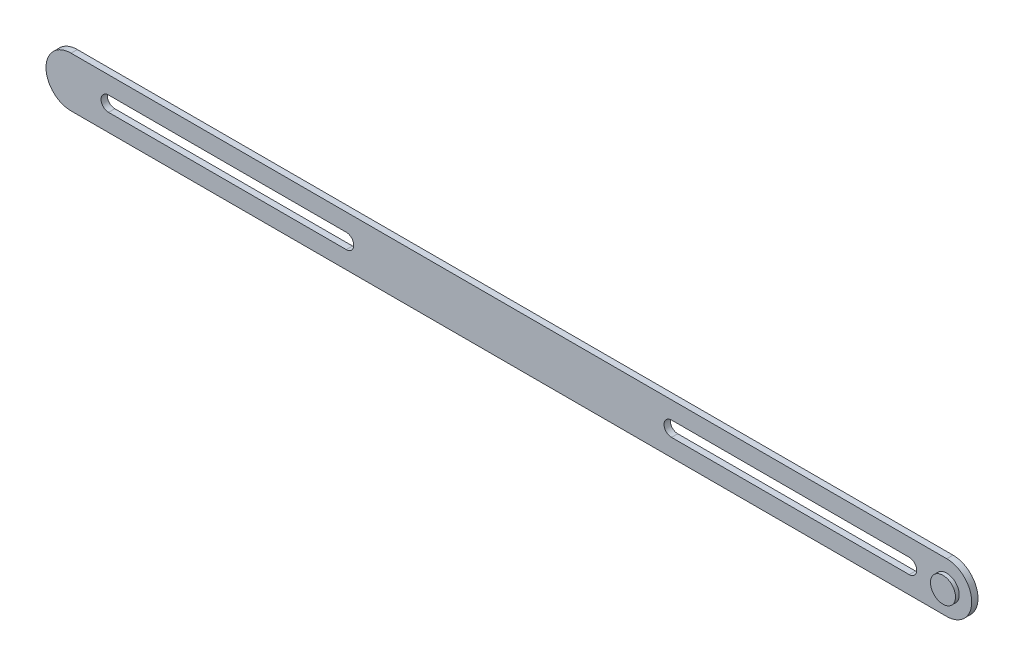
from build123d import *

# Parameters (mm, degrees)
SKETCH1_R                = 2.5
BOSS_EXTRUDE1_DEPTH      = 4
SKETCH3_R                = 5
BOSS_EXTRUDE2_DEPTH      = 2.5
BOSS_EXTRUDE3_DEPTH      = 3.5
BOSS_EXTRUDE3_DEPTH_BACK = 4
SKETCH4_R                = 5


with BuildPart() as part:
    # Sketch1 → Boss-Extrude1 (new body)
    with BuildSketch(Plane.XY):
        Circle(SKETCH1_R)
    extrude(amount=BOSS_EXTRUDE1_DEPTH)

    # Sketch3 → Boss-Extrude2 (add)
    with BuildSketch(Plane.XY.offset(4)):
        with BuildLine():
            Line((0, 10), (350, 10))
            ThreePointArc((350, 10), (360, 0), (350, -10))
            Line((350, -10), (0, -10))
            ThreePointArc((0, -10), (-10, 0), (0, 10))
        make_face()
        with Locations((350, 0)):
            Circle(SKETCH3_R, mode=Mode.SUBTRACT)
        with BuildLine():
            Line((15, 3), (110, 3))
            ThreePointArc((110, 3), (113, 0), (110, -3))
            Line((110, -3), (15, -3))
            ThreePointArc((15, -3), (12, 0), (15, 3))
        make_face(mode=Mode.SUBTRACT)
        with BuildLine():
            Line((335, 3), (240, 3))
            ThreePointArc((240, 3), (237, 0), (240, -3))
            Line((240, -3), (335, -3))
            ThreePointArc((335, -3), (338, 0), (335, 3))
        make_face(mode=Mode.SUBTRACT)
    extrude(amount=BOSS_EXTRUDE2_DEPTH)

    # Sketch4 → Boss-Extrude3 (add, two sides: drawn at the far end of the back side and taken through both)
    with BuildSketch(Plane(origin=(0, 0, 4), x_dir=(-1, 0, 0), z_dir=(0, 0, -1)).offset(-BOSS_EXTRUDE3_DEPTH_BACK)):
        with Locations((-350, 0)):
            Circle(SKETCH4_R)
    extrude(amount=BOSS_EXTRUDE3_DEPTH + BOSS_EXTRUDE3_DEPTH_BACK)


solid = part.part
